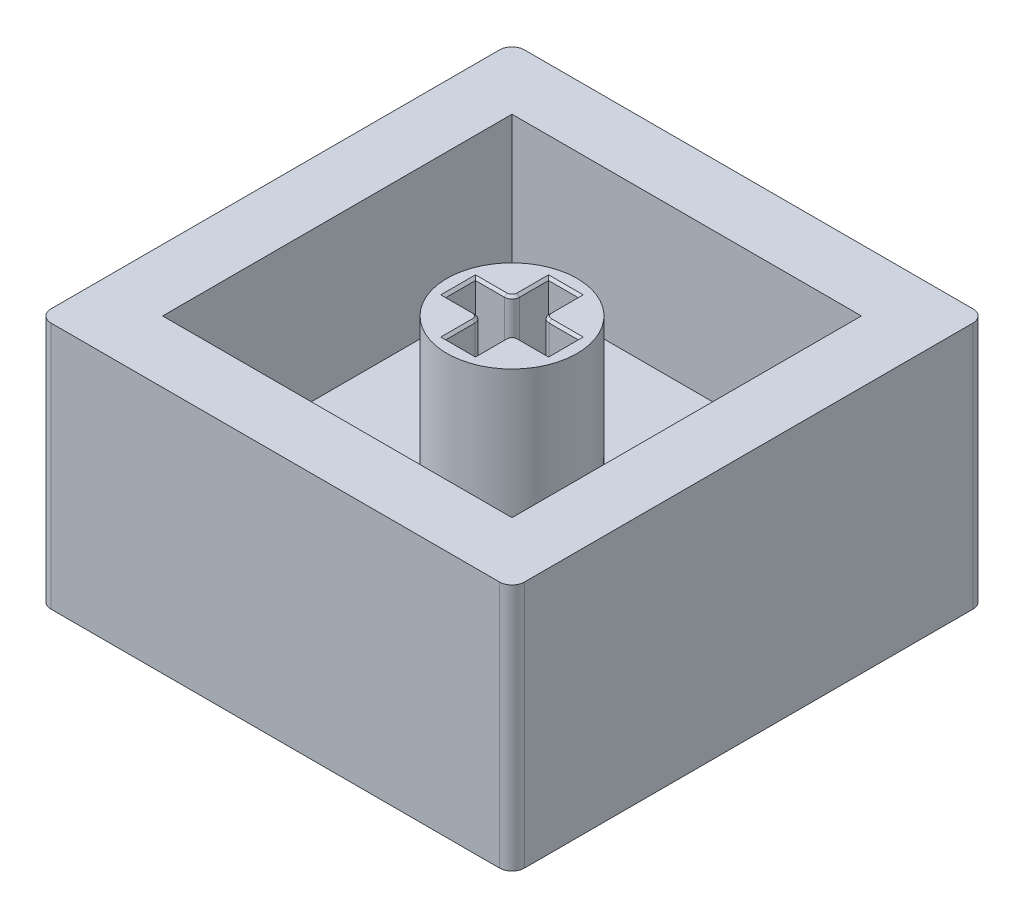
from build123d import *

# Parameters (mm, degrees)
SKETCH1_W           = 19.1
SKETCH1_H           = 19.1
SKETCH1_W_2         = 14.1
SKETCH1_H_2         = 14.1
BOSS_EXTRUDE1_DEPTH = 4
SKETCH1_3_W         = 19.1
SKETCH1_3_H         = 19.1
SKETCH1_3_W_2       = 14.1
SKETCH1_3_H_2       = 14.1
BOSS_EXTRUDE2_DEPTH = 10
SKETCH2_R           = 2.625
BOSS_EXTRUDE3_DEPTH = 6
CHAMFER1_SIZE       = 0.1
FILLET1_R           = 0.5


with BuildPart() as part:
    # Sketch1 → Boss-Extrude1 (new body)
    # profile 1 of 2: a face of its own
    with BuildSketch(Plane(origin=(0, 0, 0), x_dir=(1, 0, 0), z_dir=(0, 1, 0))):
        with Locations((7.05, 7.05)):
            Rectangle(SKETCH1_W, SKETCH1_H)
        with Locations((7.05, 7.05)):
            Rectangle(SKETCH1_W_2, SKETCH1_H_2, mode=Mode.SUBTRACT)
    # profile 2 of 2: a face of its own
    with BuildSketch(Plane(origin=(0, 0, 0), x_dir=(1, 0, 0), z_dir=(0, 1, 0))):
        with Locations((7.05, 7.05)):
            Rectangle(SKETCH1_W_2, SKETCH1_H_2)
    extrude(amount=BOSS_EXTRUDE1_DEPTH)

    # Sketch1<3> → Boss-Extrude2 (add)
    with BuildSketch(Plane(origin=(0, 0, 0), x_dir=(1, 0, 0), z_dir=(0, 1, 0))):
        with Locations((7.05, 7.05)):
            Rectangle(SKETCH1_3_W, SKETCH1_3_H)
        with Locations((7.05, 7.05)):
            Rectangle(SKETCH1_3_W_2, SKETCH1_3_H_2, mode=Mode.SUBTRACT)
    extrude(amount=BOSS_EXTRUDE2_DEPTH)

    # Sketch2 → Boss-Extrude3 (add)
    with BuildSketch(Plane(origin=(0, 4, 0), x_dir=(1, 0, 0), z_dir=(0, 1, 0))):
        with Locations(Location((7.05, 7.05, 0), (0, 0, 90))):
            Circle(SKETCH2_R)
        with BuildLine():
            Line((6.15, 6.45), (4.975, 6.45))
            Line((4.975, 6.45), (4.975, 7.65))
            Line((4.975, 7.65), (6.15, 7.65))
            ThreePointArc((6.15, 7.65), (6.362132034, 7.737867966), (6.45, 7.95))
            Line((6.45, 7.95), (6.45, 9.125))
            Line((6.45, 9.125), (7.65, 9.125))
            Line((7.65, 9.125), (7.65, 7.95))
            ThreePointArc((7.65, 7.95), (7.737867966, 7.737867966), (7.95, 7.65))
            Line((7.95, 7.65), (9.125, 7.65))
            Line((9.125, 7.65), (9.125, 6.45))
            Line((9.125, 6.45), (7.95, 6.45))
            ThreePointArc((7.95, 6.45), (7.737867966, 6.362132034), (7.65, 6.15))
            Line((7.65, 6.15), (7.65, 4.975))
            Line((7.65, 4.975), (6.45, 4.975))
            Line((6.45, 4.975), (6.45, 6.15))
            ThreePointArc((6.45, 6.15), (6.362132034, 6.362132034), (6.15, 6.45))
        make_face(mode=Mode.SUBTRACT)
    extrude(amount=BOSS_EXTRUDE3_DEPTH)

    # Chamfer1
    chamfer1_edges = [part.edges().sort_by_distance(p)[0] for p in [
        (5.5625, 10, -6.45),
        (7.05, 10, -9.125),
        (7.65, 10, -8.5375),
        (9.125, 10, -7.05),
        (8.5375, 10, -6.45),
        (7.65, 10, -5.5625),
        (7.05, 10, -4.975),
        (6.45, 10, -5.5625),
        (6.362132034, 10, -6.362132034),
        (4.975, 10, -7.05),
        (5.5625, 10, -7.65),
        (6.362132034, 10, -7.737867966),
        (6.45, 10, -8.5375),
        (7.737867966, 10, -7.737867966),
        (8.5375, 10, -7.65),
        (7.737867966, 10, -6.362132034),
    ]]
    chamfer(chamfer1_edges, length=CHAMFER1_SIZE)

    # Fillet1
    fillet1_edges = [part.edges().sort_by_distance(p)[0] for p in [
        (-2.5, 5, -16.6),
        (16.6, 5, -16.6),
        (16.6, 5, 2.5),
        (-2.5, 5, 2.5),
    ]]
    fillet(fillet1_edges, radius=FILLET1_R)


solid = part.part
